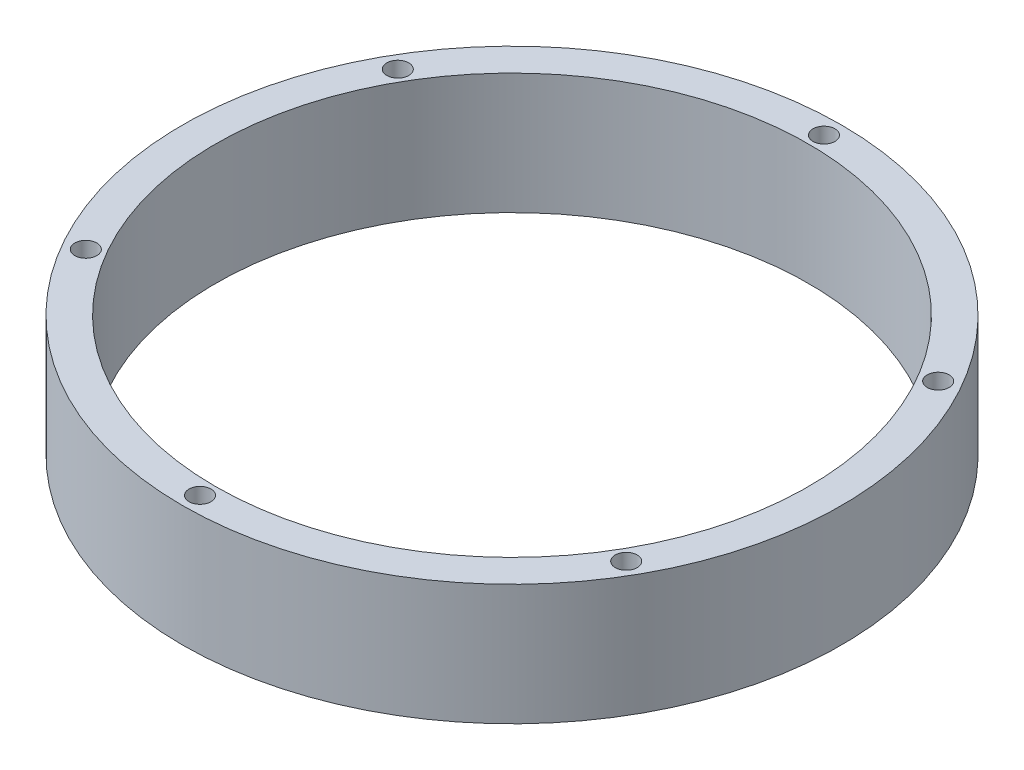
from build123d import *

# Parameters (mm, degrees)
SKETCH1_R           = 15
SKETCH1_R_2         = 13.5
BOSS_EXTRUDE1_DEPTH = 5.5
SKETCH2_R           = 0.5
CUT_EXTRUDE1_DEPTH  = 5.5
CIRPATTERN1_COUNT   = 6
SCALE1_SCALE        = 5


with BuildPart() as part:
    # Sketch1 → Boss-Extrude1 (new body)
    with BuildSketch(Plane(origin=(0, 0, 0), x_dir=(1, 0, 0), z_dir=(0, 1, 0))):
        with Locations(Location((0, 0, 0), (0, 0, 270))):
            Circle(SKETCH1_R)
        with Locations(Location((0, 0, 0), (0, 0, 270))):
            Circle(SKETCH1_R_2, mode=Mode.SUBTRACT)
    extrude(amount=BOSS_EXTRUDE1_DEPTH)

    # Sketch2 → Cut-Extrude1 (cut)
    with BuildSketch(Plane(origin=(0, 5.5, 0), x_dir=(1, 0, 0), z_dir=(0, 1, 0))):
        with Locations(Location((0, 14.2, 0), (0, 0, 270))):
            Circle(SKETCH2_R)
    cut_extrude1 = extrude(amount=-CUT_EXTRUDE1_DEPTH, mode=Mode.SUBTRACT)

    # CirPattern1: Cut-Extrude1 ×6 about axis
    cirpattern1_axis = Axis((0, 0, 0), (0, 1, 0))
    for i in range(1, CIRPATTERN1_COUNT):
        add(cut_extrude1.rotate(cirpattern1_axis, i * 360 / CIRPATTERN1_COUNT), mode=Mode.SUBTRACT)


with BuildPart() as part_1:
    # Scale1: scaled about (0, 2.75, 0)
    add(part.part.scale(SCALE1_SCALE).moved(Location((0, -11, 0))))


solid = part_1.part
